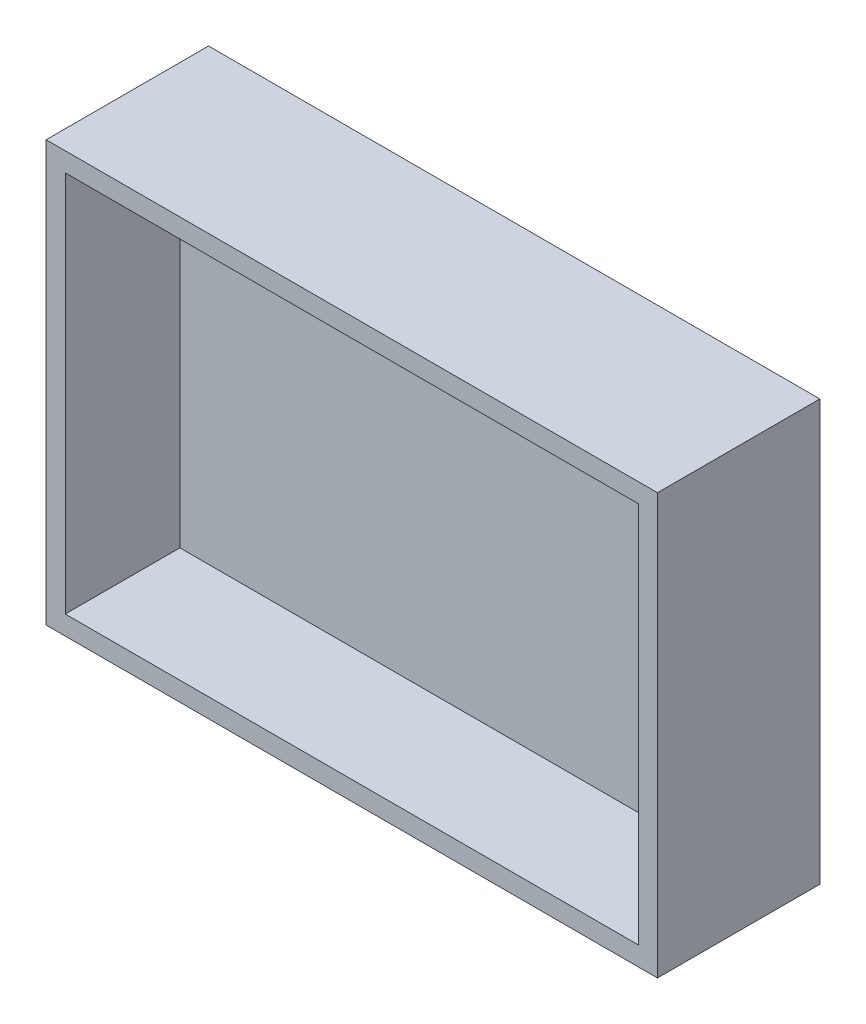
from build123d import *

# Parameters (mm, degrees)
CROQUIS1_W              = 64
CROQUIS1_H              = 44
CROQUIS1_W_2            = 60
CROQUIS1_H_2            = 40
SALIENTE_EXTRUIR1_DEPTH = 12
CROQUIS2_W              = 64
CROQUIS2_H              = 44
SALIENTE_EXTRUIR2_DEPTH = 5


with BuildPart() as part:
    # Croquis1 → Saliente-Extruir1 (new body)
    with BuildSketch(Plane.XY):
        with Locations((-30, 20)):
            Rectangle(CROQUIS1_W, CROQUIS1_H)
        with Locations((-30, 20)):
            Rectangle(CROQUIS1_W_2, CROQUIS1_H_2, mode=Mode.SUBTRACT)
    extrude(amount=SALIENTE_EXTRUIR1_DEPTH)

    # Croquis2 → Saliente-Extruir2 (add)
    with BuildSketch(Plane(origin=(0, 0, 0), x_dir=(-1, 0, 0), z_dir=(0, 0, -1))):
        with Locations((30, 20)):
            Rectangle(CROQUIS2_W, CROQUIS2_H)
    extrude(amount=SALIENTE_EXTRUIR2_DEPTH)


solid = part.part
